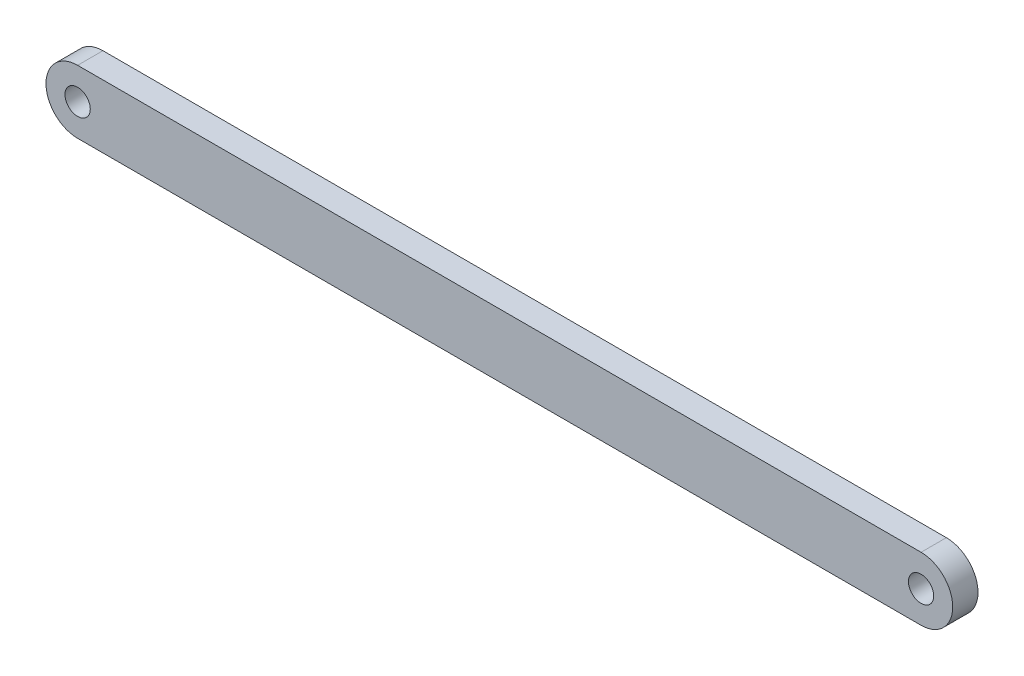
from build123d import *

# Parameters (mm, degrees)
SKETCH2_R           = 3.75
SKETCH2_R_2         = 1.5
BOSS_EXTRUDE1_DEPTH = 3


with BuildPart() as part:
    # Sketch2 → Boss-Extrude1 (new body)
    # profile 1 of 3: a face of its own
    with BuildSketch(Plane.XY):
        Circle(SKETCH2_R)
        Circle(SKETCH2_R_2, mode=Mode.SUBTRACT)
    # profile 2 of 3: a face of its own
    with BuildSketch(Plane.XY):
        with BuildLine():
            ThreePointArc((3.75, 0), (2.651650429, -2.651650429), (0, -3.75))
            Line((0, -3.75), (100, -3.75))
            ThreePointArc((100, -3.75), (96.25, 0), (100, 3.75))
            Line((100, 3.75), (0, 3.75))
            ThreePointArc((0, 3.75), (2.651650429, 2.651650429), (3.75, 0))
        make_face()
    # profile 3 of 3: a face of its own
    with BuildSketch(Plane.XY):
        with Locations((100, 0)):
            Circle(SKETCH2_R)
        with Locations((100, 0)):
            Circle(SKETCH2_R_2, mode=Mode.SUBTRACT)
    extrude(amount=BOSS_EXTRUDE1_DEPTH)


solid = part.part
